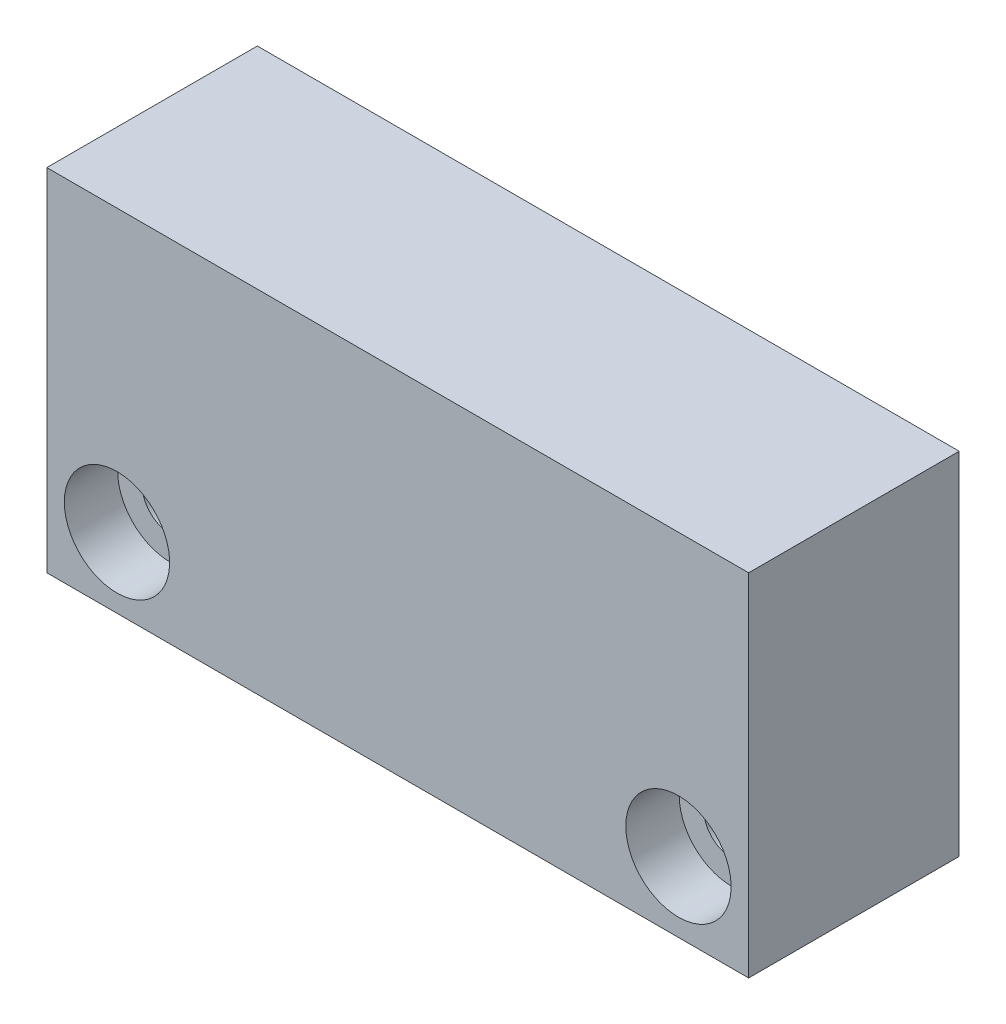
from build123d import *

# Parameters (mm, degrees)
SKETCH1_W           = 63.5
SKETCH1_H           = 31.75
SKETCH1_R           = 4.7625
BOSS_EXTRUDE1_DEPTH = 19.05
SKETCH1_3_R         = 4.7625
SKETCH1_3_R_2       = 2.5527
BOSS_EXTRUDE2_DEPTH = 14.224


with BuildPart() as part:
    # Sketch1 → Boss-Extrude1 (new body)
    with BuildSketch(Plane.XY):
        with Locations((4.146938776, -4.146938776)):
            Rectangle(SKETCH1_W, SKETCH1_H)
        with Locations((-21.253061224, -13.671938776)):
            Circle(SKETCH1_R, mode=Mode.SUBTRACT)
        with Locations((29.546938776, -13.671938776)):
            Circle(SKETCH1_R, mode=Mode.SUBTRACT)
    extrude(amount=BOSS_EXTRUDE1_DEPTH)

    # Sketch1<3> → Boss-Extrude2 (add)
    # profile 1 of 2: a face of its own
    with BuildSketch(Plane.XY):
        with Locations((-21.253061224, -13.671938776)):
            Circle(SKETCH1_3_R)
        with Locations((-21.253061224, -13.671938776)):
            Circle(SKETCH1_3_R_2, mode=Mode.SUBTRACT)
    # profile 2 of 2: a face of its own
    with BuildSketch(Plane.XY):
        with Locations((29.546938776, -13.671938776)):
            Circle(SKETCH1_3_R)
        with Locations((29.546938776, -13.671938776)):
            Circle(SKETCH1_3_R_2, mode=Mode.SUBTRACT)
    extrude(amount=BOSS_EXTRUDE2_DEPTH)


solid = part.part
